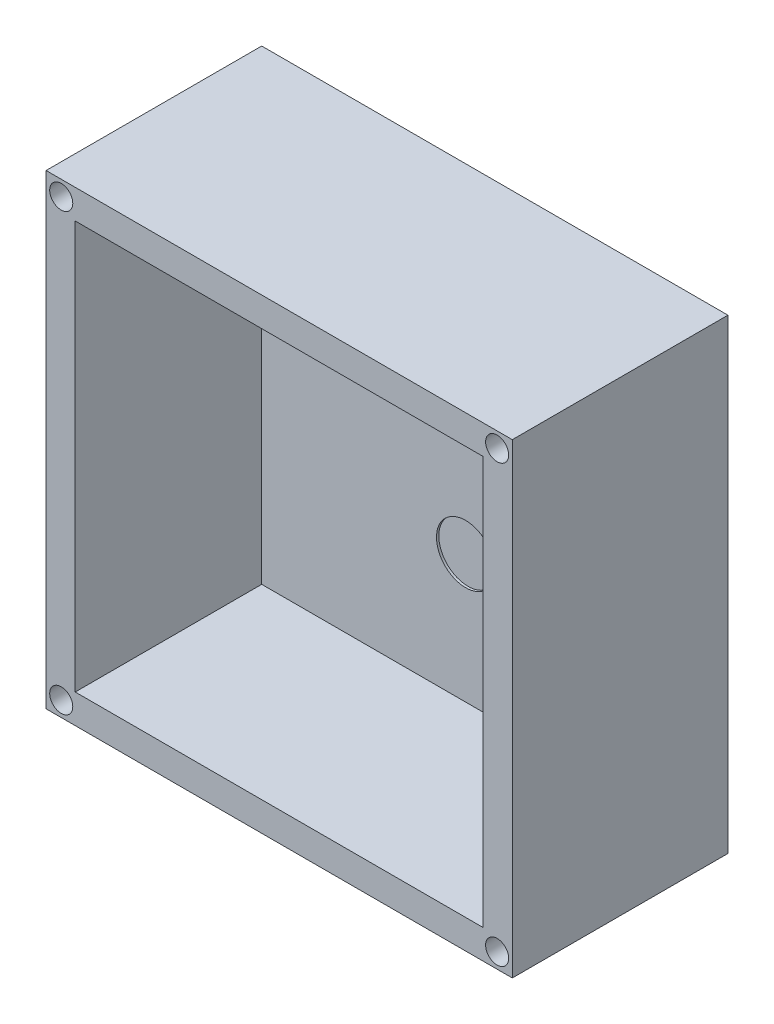
from build123d import *

# Parameters (mm, degrees)
SKETCH1_W           = 50.8
SKETCH1_H           = 50.8
BOSS_EXTRUDE1_DEPTH = 3.175
SKETCH3_W           = 50.8
SKETCH3_H           = 50.8
SKETCH3_W_2         = 44.4373
SKETCH3_H_2         = 44.45
BOSS_EXTRUDE2_DEPTH = 20.32
SKETCH4_R           = 3.175
CUT_EXTRUDE1_DEPTH  = 0.254
SKETCH6_R           = 1.2573
CUT_EXTRUDE2_DEPTH  = 9.525
SKETCH4_3_R         = 3.175
CUT_EXTRUDE3_DEPTH  = 75.66044736


with BuildPart() as part:
    # Sketch1 → Boss-Extrude1 (new body)
    with BuildSketch(Plane.XY):
        with Locations((25.4, 25.4)):
            Rectangle(SKETCH1_W, SKETCH1_H)
    extrude(amount=BOSS_EXTRUDE1_DEPTH)

    # Sketch3 → Boss-Extrude2 (add)
    with BuildSketch(Plane.XY.offset(3.175)):
        with Locations((25.4, 25.4)):
            Rectangle(SKETCH3_W, SKETCH3_H)
        with Locations((25.39365, 25.4)):
            Rectangle(SKETCH3_W_2, SKETCH3_H_2, mode=Mode.SUBTRACT)
    extrude(amount=BOSS_EXTRUDE2_DEPTH)

    # Sketch4 → Cut-Extrude1 (cut)
    with BuildSketch(Plane.XY.offset(3.175)):
        with Locations((25.39365, 17.145)):
            Circle(SKETCH4_R)
    extrude(amount=-CUT_EXTRUDE1_DEPTH, mode=Mode.SUBTRACT)

    # Sketch6 → Cut-Extrude2 (cut)
    with BuildSketch(Plane.XY.offset(23.495)):
        with Locations((1.651, 49.149)):
            Circle(SKETCH6_R)
        with Locations((49.149, 49.149)):
            Circle(SKETCH6_R)
        with Locations((49.149, 1.651)):
            Circle(SKETCH6_R)
        with Locations((1.651, 1.651)):
            Circle(SKETCH6_R)
    extrude(amount=-CUT_EXTRUDE2_DEPTH, mode=Mode.SUBTRACT)

    # Sketch4<3> → Cut-Extrude3 (cut, through all)
    with BuildSketch(Plane.XY.offset(3.175)):
        with Locations((25.39365, 35.1409)):
            Circle(SKETCH4_3_R)
    extrude(amount=-CUT_EXTRUDE3_DEPTH, mode=Mode.SUBTRACT)


solid = part.part
